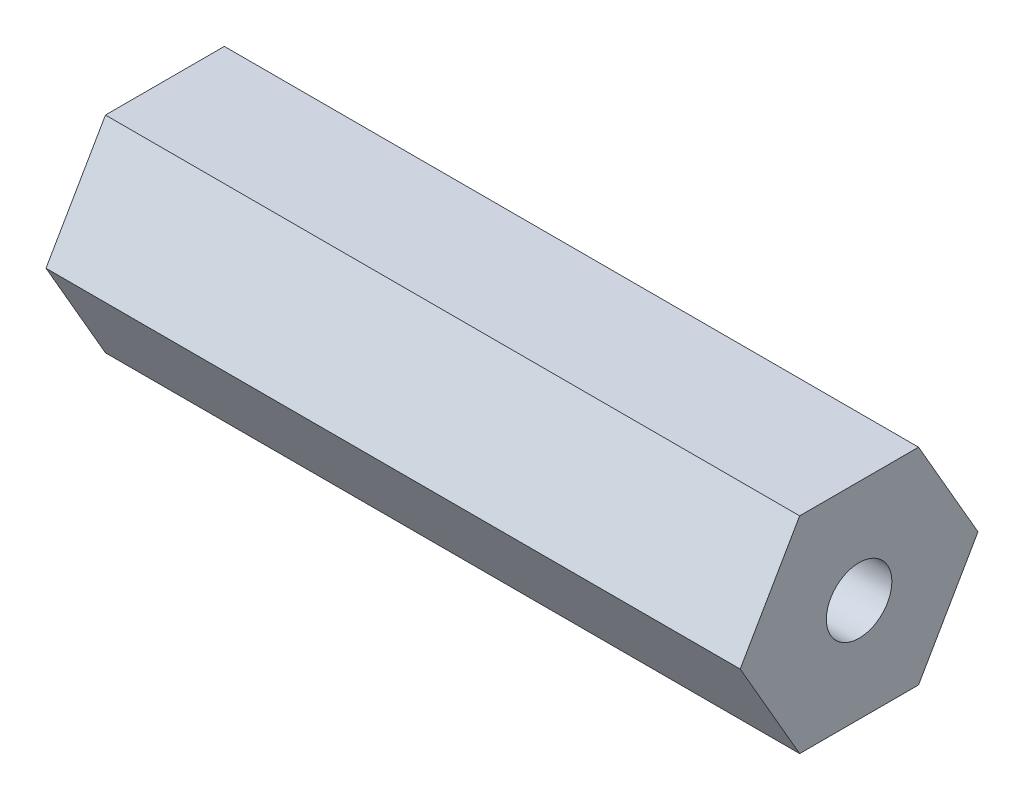
from build123d import *

# Parameters (mm, degrees)
SKETCH1_R           = 2.0193
BOSS_EXTRUDE1_DEPTH = 42.8117


with BuildPart() as part:
    # Sketch1 → Boss-Extrude1 (new body)
    with BuildSketch(Plane(origin=(0, 0, 0), x_dir=(0, 0, -1), z_dir=(1, 0, 0))):
        Polygon((7.332348419, 0), (3.666174209, 6.35), (-3.666174209, 6.35), (-7.332348419, 0), (-3.666174209, -6.35), (3.666174209, -6.35), align=None)
        Circle(SKETCH1_R, mode=Mode.SUBTRACT)
    extrude(amount=BOSS_EXTRUDE1_DEPTH)


solid = part.part
